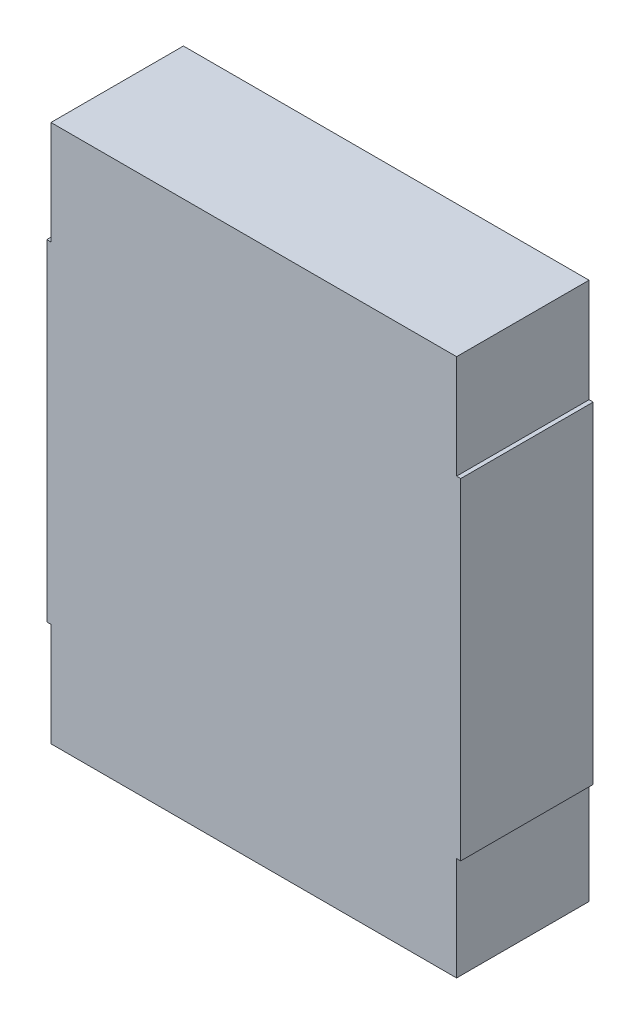
from build123d import *

# Parameters (mm, degrees)
COMPONENT_OUTLINE_DEPTH = 1.6


with BuildPart() as part:
    # 草图1 → Component_Outline (new body)
    with BuildSketch(Plane.XY):
        Polygon((-2.5, 2), (-2.45, 2), (-2.45, 3.25), (2.45, 3.25), (2.45, 2), (2.5, 2), (2.5, -2), (2.45, -2), (2.45, -3.25), (-2.45, -3.25), (-2.45, -2), (-2.5, -2), align=None)
    extrude(amount=COMPONENT_OUTLINE_DEPTH)


solid = part.part
